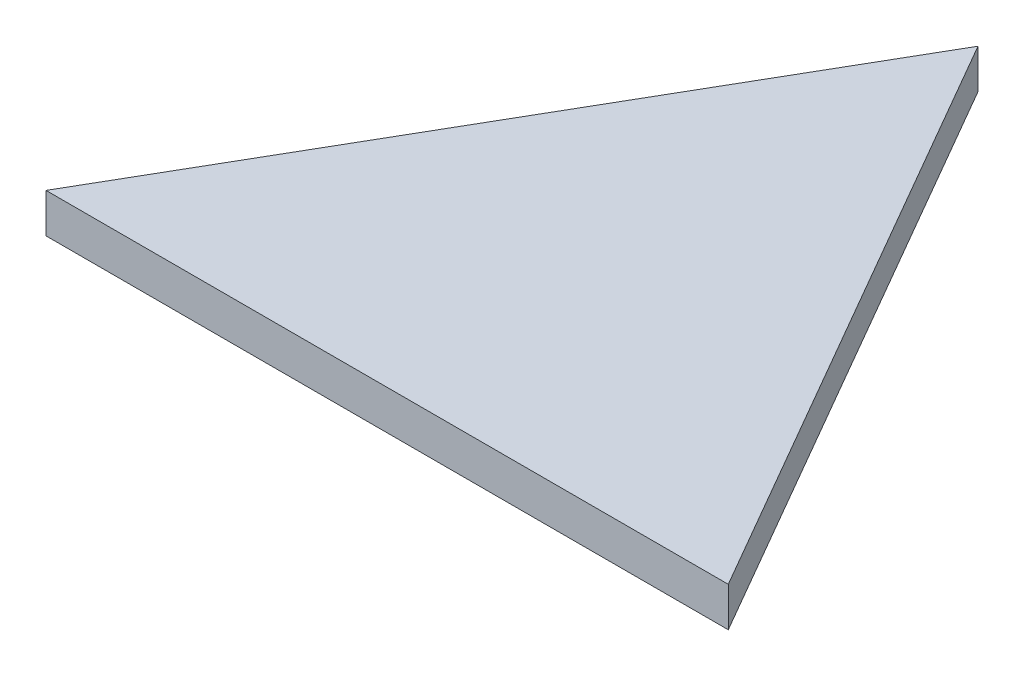
from build123d import *

# Parameters (mm, degrees)
EXTRUDE_1_DEPTH = 10


with BuildPart() as part:
    # 草图1 → 凸台-拉伸1 (new body)
    with BuildSketch(Plane(origin=(0, 0, 0), x_dir=(1, 0, 0), z_dir=(0, 1, 0))):
        Polygon((0, 100), (-86.602540378, -50), (86.602540378, -50), align=None)
    extrude(amount=EXTRUDE_1_DEPTH)


solid = part.part
